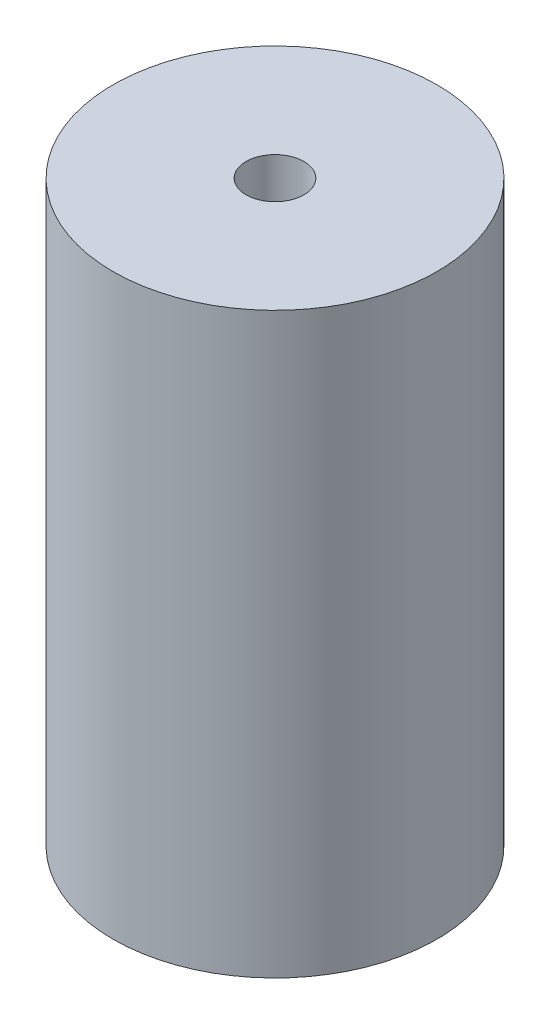
from build123d import *

# Parameters (mm, degrees)
SKETCH1_R           = 14
SKETCH1_R_2         = 2.5
BOSS_EXTRUDE1_DEPTH = 50


with BuildPart() as part:
    # Sketch1 → Boss-Extrude1 (new body)
    with BuildSketch(Plane(origin=(0, 0, 0), x_dir=(1, 0, 0), z_dir=(0, 1, 0))):
        with Locations(Location((0, 0, 0), (0, 0, 270))):
            Circle(SKETCH1_R)
        with Locations(Location((0, 0, 0), (0, 0, 270))):
            Circle(SKETCH1_R_2, mode=Mode.SUBTRACT)
    extrude(amount=BOSS_EXTRUDE1_DEPTH)


solid = part.part
